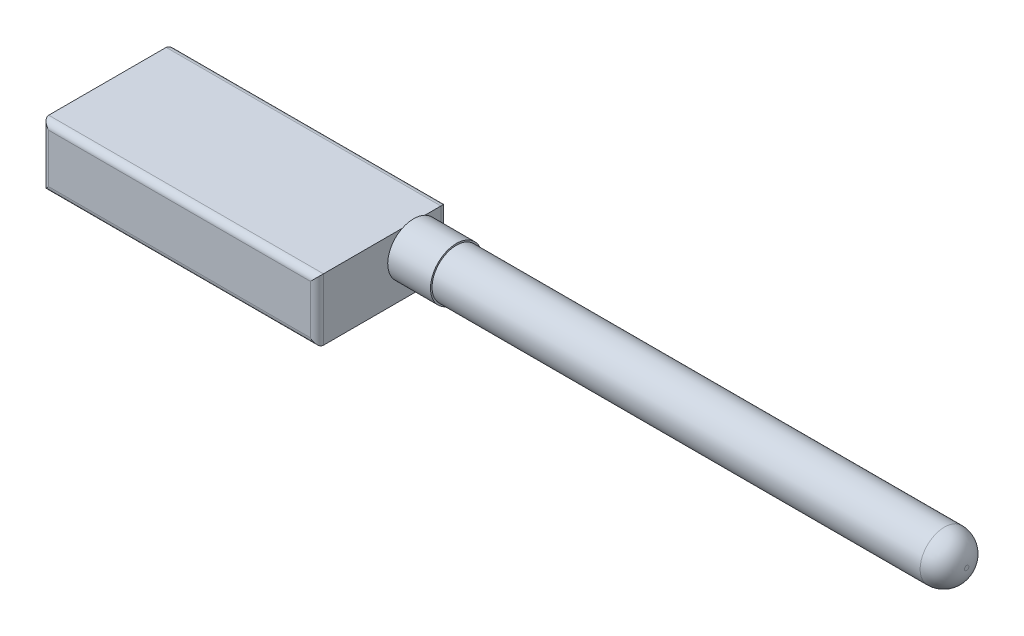
from build123d import *

# Parameters (mm, degrees)
SKETCH1_W           = 53.52
SKETCH1_H           = 25.42
BOSS_EXTRUDE2_DEPTH = 12.06
SKETCH2_R           = 5.05
BOSS_EXTRUDE3_DEPTH = 8.33
SKETCH3_R           = 4.745
BOSS_EXTRUDE4_DEPTH = 12
SKETCH4_R           = 4.745
BOSS_EXTRUDE5_DEPTH = 87.4
FILLET1_R           = 4.318
FILLET2_R           = 1.27
FILLET3_R           = 1.27


with BuildPart() as part:
    # Sketch1 → Boss-Extrude2 (new body)
    with BuildSketch(Plane(origin=(0, 0, 0), x_dir=(1, 0, 0), z_dir=(0, 1, 0))):
        with Locations((0.655882353, 2.019117647)):
            Rectangle(SKETCH1_W, SKETCH1_H)
    extrude(amount=BOSS_EXTRUDE2_DEPTH)

    # Sketch2 → Boss-Extrude3 (add)
    with BuildSketch(Plane(origin=(27.415882353, 0, 0), x_dir=(0, 0, -1), z_dir=(1, 0, 0))):
        with Locations(Location((8.151317647, 7.5138, 0), (0, 0, 115.810680581))):
            Circle(SKETCH2_R)
    extrude(amount=BOSS_EXTRUDE3_DEPTH)

    # Sketch3 → Boss-Extrude4 (add)
    with BuildSketch(Plane(origin=(35.745882353, 0, 0), x_dir=(0, 0, -1), z_dir=(1, 0, 0))):
        with Locations((8.151317647, 7.5138)):
            Circle(SKETCH3_R)
    extrude(amount=BOSS_EXTRUDE4_DEPTH)

    # Sketch4 → Boss-Extrude5 (add)
    with BuildSketch(Plane(origin=(47.745882353, 0, 0), x_dir=(0, 0, -1), z_dir=(1, 0, 0))):
        with Locations((8.151317647, 7.5138)):
            Circle(SKETCH4_R)
    extrude(amount=BOSS_EXTRUDE5_DEPTH)

    # Fillet1
    fillet1_edges = [part.edges().sort_by_distance(p)[0] for p in [
        (135.145882353, 7.5138, -3.406317647),
    ]]
    fillet(fillet1_edges, radius=FILLET1_R)

    # Fillet2
    fillet2_edges = [part.edges().sort_by_distance(p)[0] for p in [
        (0.655882353, 0, 10.690882353),
        (0.655882353, 12.06, 10.690882353),
        (27.415882353, 6.03, 10.690882353),
        (-26.104117647, 6.03, 10.690882353),
    ]]
    fillet(fillet2_edges, radius=FILLET2_R)

    # Fillet3
    fillet3_edges = [part.edges().sort_by_distance(p)[0] for p in [
        (0.655882353, 12.06, -14.729117647),
        (0.655882353, 0, -14.729117647),
        (-26.104117647, 6.03, -14.729117647),
        (27.415882353, 6.03, -14.729117647),
    ]]
    fillet(fillet3_edges, radius=FILLET3_R)


solid = part.part
